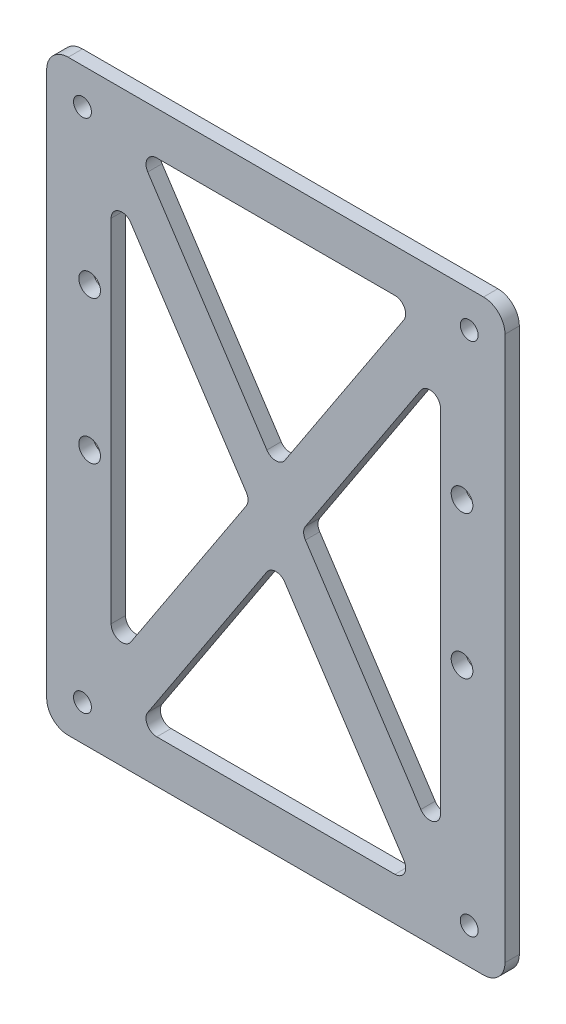
from build123d import *

# Parameters (mm, degrees)
SKETCH_1_W          = 64
SKETCH_1_H          = 82
SKETCH_1_R          = 1.25
EXTRUDE_1_DEPTH     = 2
FILLET_1_R          = 3
SKETCH_3_R          = 1.515
CUT_EXTRUDE_1_DEPTH = 10
CUT_EXTRUDE_2_DEPTH = 10
FILLET_2_R          = 1.5


with BuildPart() as part:
    # 草图1 → 凸台-拉伸1 (new body)
    with BuildSketch(Plane.XY):
        Rectangle(SKETCH_1_W, SKETCH_1_H)
        with Locations((-27, 36)):
            Circle(SKETCH_1_R, mode=Mode.SUBTRACT)
        with Locations((27, 36)):
            Circle(SKETCH_1_R, mode=Mode.SUBTRACT)
        with Locations((27, -36)):
            Circle(SKETCH_1_R, mode=Mode.SUBTRACT)
        with Locations((-27, -36)):
            Circle(SKETCH_1_R, mode=Mode.SUBTRACT)
    extrude(amount=EXTRUDE_1_DEPTH)

    # 圆角1
    fillet_1_edges = [part.edges().sort_by_distance(p)[0] for p in [
        (32, -41, 1),
        (-32, -41, 1),
        (-32, 41, 1),
        (32, 41, 1),
    ]]
    fillet(fillet_1_edges, radius=FILLET_1_R)

    # 草图3 → 切除-拉伸1 (cut)
    with BuildSketch(Plane.XY.offset(2)):
        with Locations((-26, 15)):
            Circle(SKETCH_3_R)
        with Locations((-26, -5)):
            Circle(SKETCH_3_R)
        with Locations(Location((26, -5, 0), (0, 0, 180))):
            Circle(SKETCH_3_R)
        with Locations(Location((26, 15, 0), (0, 0, 180))):
            Circle(SKETCH_3_R)
    extrude(amount=-CUT_EXTRUDE_1_DEPTH, mode=Mode.SUBTRACT)

    # 草图4 → 切除-拉伸2 (cut)
    with BuildSketch(Plane.XY.offset(2)):
        Polygon((-23, 29.53728915), (-23, -29.53728915), (-3.589781416, 0), align=None)
        Polygon((-19.410218584, 35), (0, 5.46271085), (19.410218584, 35), align=None)
        Polygon((23, 29.53728915), (3.589781416, 0), (23, -29.53728915), align=None)
        Polygon((0, -5.46271085), (-19.410218584, -35), (19.410218584, -35), align=None)
    extrude(amount=-CUT_EXTRUDE_2_DEPTH, mode=Mode.SUBTRACT)

    # 圆角2
    fillet_2_edges = [part.edges().sort_by_distance(p)[0] for p in [
        (0, -5.46271085, 1),
        (19.410218584, -35, 1),
        (-19.410218584, -35, 1),
        (-23, 29.53728915, 1),
        (-3.589781416, 0, 1),
        (-23, -29.53728915, 1),
        (3.589781416, 0, 1),
        (23, 29.53728915, 1),
        (23, -29.53728915, 1),
        (-19.410218584, 35, 1),
        (19.410218584, 35, 1),
        (0, 5.46271085, 1),
    ]]
    fillet(fillet_2_edges, radius=FILLET_2_R)


solid = part.part
